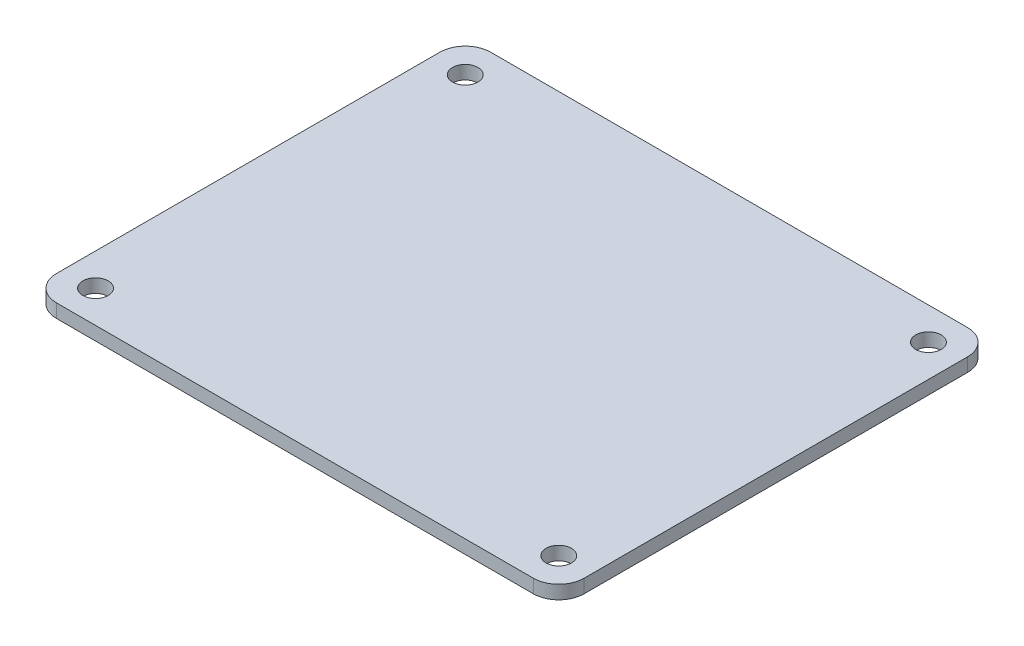
from build123d import *

# Parameters (mm, degrees)
SKETCH_1_R      = 1.5
EXTRUDE_1_DEPTH = 1.6


with BuildPart() as part:
    # 草图1 → 凸台-拉伸1 (new body)
    with BuildSketch(Plane(origin=(0, 0, 0), x_dir=(1, 0, 0), z_dir=(0, 1, 0))):
        with BuildLine():
            Line((-22.857389118, 23.002146128), (33.502610882, 23.002146128))
            ThreePointArc((33.502610882, 23.002146128), (35.623931226, 22.123466471), (36.502610882, 20.002146128))
            Line((36.502610882, 20.002146128), (36.502610882, -25.307853872))
            ThreePointArc((36.502610882, -25.307853872), (35.623931226, -27.429174216), (33.502610882, -28.307853872))
            Line((33.502610882, -28.307853872), (-22.857389118, -28.307853872))
            ThreePointArc((-22.857389118, -28.307853872), (-24.978709461, -27.429174216), (-25.857389118, -25.307853872))
            Line((-25.857389118, -25.307853872), (-25.857389118, 20.002146128))
            ThreePointArc((-25.857389118, 20.002146128), (-24.978709461, 22.123466471), (-22.857389118, 23.002146128))
        make_face()
        with Locations(Location((-22.047389118, 19.192146128, 0), (0, 0, 270))):
            Circle(SKETCH_1_R, mode=Mode.SUBTRACT)
        with Locations(Location((32.692610882, 19.192146128, 0), (0, 0, 270))):
            Circle(SKETCH_1_R, mode=Mode.SUBTRACT)
        with Locations(Location((-22.047389118, -24.497853872, 0), (0, 0, 270))):
            Circle(SKETCH_1_R, mode=Mode.SUBTRACT)
        with Locations(Location((32.692610882, -24.497853872, 0), (0, 0, 270))):
            Circle(SKETCH_1_R, mode=Mode.SUBTRACT)
    extrude(amount=EXTRUDE_1_DEPTH)


solid = part.part
